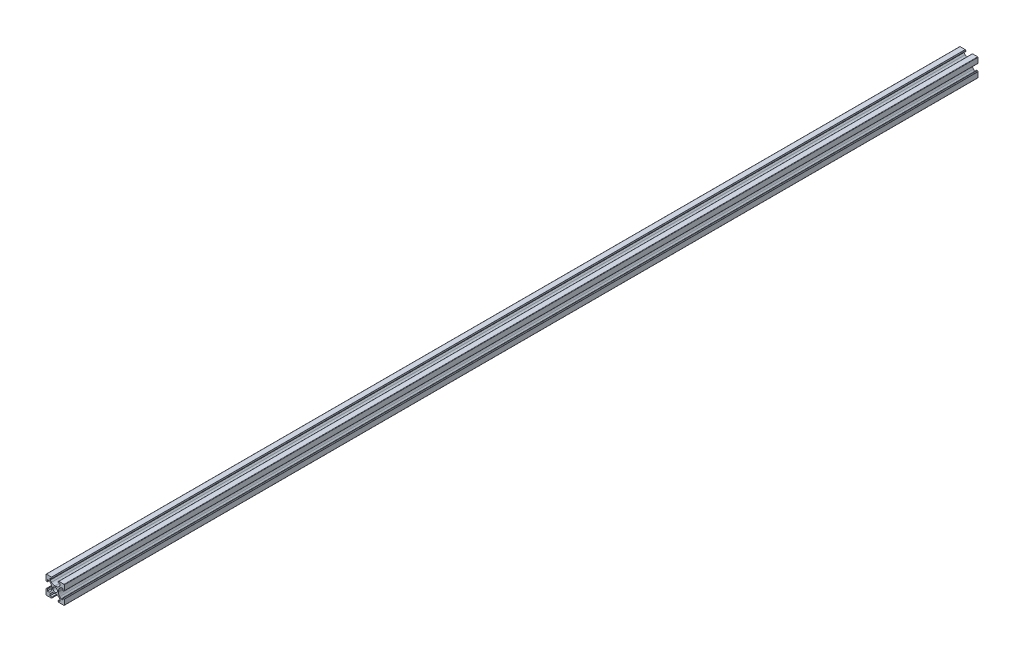
from build123d import *

# Parameters (mm, degrees)
RESSALTO_EXTRUS_O1_DEPTH = 1000
PADR_OCIRCULAR1_COUNT    = 4
FILETE1_R                = 0.4


with BuildPart() as part:
    # Esboço1 → Ressalto-extrusão1 (new body)
    with BuildSketch(Plane.XY):
        with BuildLine():
            ThreePointArc((-9.317157288, 3.217157288), (-9.187387948, 3.130448187), (-9.034314575, 3.1))
            Line((-9.034314575, 3.1), (-8.9, 3.1))
            ThreePointArc((-8.9, 3.1), (-8.617157288, 3.217157288), (-8.5, 3.5))
            Line((-8.5, 3.5), (-8.5, 5.5))
            Line((-8.5, 5.5), (-6.560660172, 5.5))
            Line((-6.560660172, 5.5), (-5.064466094, 4.003805922))
            ThreePointArc((-5.064466094, 4.003805922), (-3.980602337, 2.381689178), (-3.6, 0.468272016))
            Line((-3.6, 0.468272016), (-3.6, 0))
            Line((-3.6, 0), (-2.5, 0))
            ThreePointArc((-2.5, 0), (-1.767766953, 1.767766953), (0, 2.5))
            Line((0, 2.5), (0, 3.6))
            Line((0, 3.6), (-0.468272016, 3.6))
            ThreePointArc((-0.468272016, 3.6), (-2.381689178, 3.980602337), (-4.003805922, 5.064466094))
            Line((-4.003805922, 5.064466094), (-5.5, 6.560660172))
            Line((-5.5, 6.560660172), (-5.5, 8.5))
            Line((-5.5, 8.5), (-3.5, 8.5))
            ThreePointArc((-3.5, 8.5), (-3.217157288, 8.617157288), (-3.1, 8.9))
            Line((-3.1, 8.9), (-3.1, 9.034314575))
            ThreePointArc((-3.1, 9.034314575), (-3.130448187, 9.187387948), (-3.217157288, 9.317157288))
            Line((-3.217157288, 9.317157288), (-3.782842712, 9.882842712))
            ThreePointArc((-3.782842712, 9.882842712), (-3.912612052, 9.969551813), (-4.065685425, 10))
            Line((-4.065685425, 10), (-10, 10))
            Line((-10, 10), (-10, 4.065685425))
            ThreePointArc((-10, 4.065685425), (-9.969551813, 3.912612052), (-9.882842712, 3.782842712))
            Line((-9.882842712, 3.782842712), (-9.317157288, 3.217157288))
        make_face()
    ressalto_extrus_o1 = extrude(amount=RESSALTO_EXTRUS_O1_DEPTH)

    # PadrãoCircular1: Ressalto-extrusão1 ×4 about axis
    padr_ocircular1_axis = Axis((0, 0, 0), (0, 0, 1))
    for i in range(1, PADR_OCIRCULAR1_COUNT):
        add(ressalto_extrus_o1.rotate(padr_ocircular1_axis, i * 360 / PADR_OCIRCULAR1_COUNT))

    # Filete1
    filete1_edges = [part.edges().sort_by_distance(p)[0] for p in [
        (10, -10, 500),
        (10, 10, 500),
        (-10, 10, 500),
        (-10, -10, 500),
    ]]
    fillet(filete1_edges, radius=FILETE1_R)


solid = part.part
